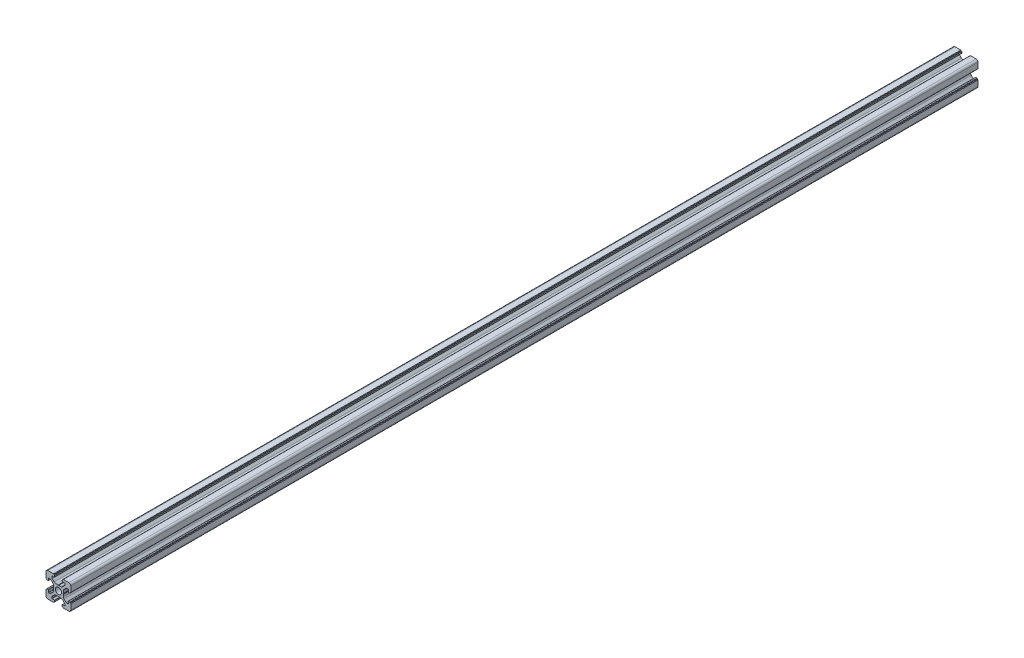
from build123d import *

# Parameters (mm, degrees)
EXTRUDE_1_DEPTH = 732


with BuildPart() as part:
    # Эскиз1 → Бобышка-Вытянуть1 (new body)
    with BuildSketch(Plane.XY):
        with BuildLine():
            Line((-3.8, 0), (-3.945217202, -0.181521503))
            ThreePointArc((-3.945217202, -0.181521503), (-3.98590708, -0.254943529), (-4, -0.337695265))
            Line((-4, -0.337695265), (-4, -1.934136008))
            ThreePointArc((-4, -1.934136008), (-4.152240935, -2.699502873), (-4.585786438, -3.348349571))
            Line((-4.585786438, -3.348349571), (-6.144543648, -4.907106781))
            ThreePointArc((-6.144543648, -4.907106781), (-6.468966997, -5.123879533), (-6.851650429, -5.2))
            Line((-6.851650429, -5.2), (-7.8, -5.2))
            ThreePointArc((-7.8, -5.2), (-7.941421356, -5.141421356), (-8, -5))
            Line((-8, -5), (-8, -3.32))
            ThreePointArc((-8, -3.32), (-8.073223305, -3.143223305), (-8.25, -3.07))
            Line((-8.25, -3.07), (-9.15, -3.07))
            ThreePointArc((-9.15, -3.07), (-9.326776695, -3.143223305), (-9.4, -3.32))
            Line((-9.4, -3.32), (-9.4, -3.7))
            Line((-9.4, -3.7), (-9.75, -3.7))
            ThreePointArc((-9.75, -3.7), (-9.926776695, -3.773223305), (-10, -3.95))
            Line((-10, -3.95), (-10, -8.5))
            ThreePointArc((-10, -8.5), (-9.560660172, -9.560660172), (-8.5, -10))
            Line((-8.5, -10), (-3.95, -10))
            ThreePointArc((-3.95, -10), (-3.773223305, -9.926776695), (-3.7, -9.75))
            Line((-3.7, -9.75), (-3.7, -9.4))
            Line((-3.7, -9.4), (-3.32, -9.4))
            ThreePointArc((-3.32, -9.4), (-3.143223305, -9.326776695), (-3.07, -9.15))
            Line((-3.07, -9.15), (-3.07, -8.25))
            ThreePointArc((-3.07, -8.25), (-3.143223305, -8.073223305), (-3.32, -8))
            Line((-3.32, -8), (-5, -8))
            ThreePointArc((-5, -8), (-5.141421356, -7.941421356), (-5.2, -7.8))
            Line((-5.2, -7.8), (-5.2, -6.851650429))
            ThreePointArc((-5.2, -6.851650429), (-5.123879533, -6.468966997), (-4.907106781, -6.144543648))
            Line((-4.907106781, -6.144543648), (-3.348349571, -4.585786438))
            ThreePointArc((-3.348349571, -4.585786438), (-2.699502873, -4.152240935), (-1.934136008, -4))
            Line((-1.934136008, -4), (-0.337695265, -4))
            ThreePointArc((-0.337695265, -4), (-0.254943529, -3.98590708), (-0.181521503, -3.945217202))
            Line((-0.181521503, -3.945217202), (0, -3.8))
            Line((0, -3.8), (0.181521503, -3.945217202))
            ThreePointArc((0.181521503, -3.945217202), (0.254943529, -3.98590708), (0.337695265, -4))
            Line((0.337695265, -4), (1.934136008, -4))
            ThreePointArc((1.934136008, -4), (2.699502873, -4.152240935), (3.348349571, -4.585786438))
            Line((3.348349571, -4.585786438), (4.907106781, -6.144543648))
            ThreePointArc((4.907106781, -6.144543648), (5.123879533, -6.468966997), (5.2, -6.851650429))
            Line((5.2, -6.851650429), (5.2, -7.8))
            ThreePointArc((5.2, -7.8), (5.141421356, -7.941421356), (5, -8))
            Line((5, -8), (3.32, -8))
            ThreePointArc((3.32, -8), (3.143223305, -8.073223305), (3.07, -8.25))
            Line((3.07, -8.25), (3.07, -9.15))
            ThreePointArc((3.07, -9.15), (3.143223305, -9.326776695), (3.32, -9.4))
            Line((3.32, -9.4), (3.7, -9.4))
            Line((3.7, -9.4), (3.7, -9.75))
            ThreePointArc((3.7, -9.75), (3.773223305, -9.926776695), (3.95, -10))
            Line((3.95, -10), (8.5, -10))
            ThreePointArc((8.5, -10), (9.560660172, -9.560660172), (10, -8.5))
            Line((10, -8.5), (10, -3.95))
            ThreePointArc((10, -3.95), (9.926776695, -3.773223305), (9.75, -3.7))
            Line((9.75, -3.7), (9.4, -3.7))
            Line((9.4, -3.7), (9.4, -3.32))
            ThreePointArc((9.4, -3.32), (9.326776695, -3.143223305), (9.15, -3.07))
            Line((9.15, -3.07), (8.25, -3.07))
            ThreePointArc((8.25, -3.07), (8.073223305, -3.143223305), (8, -3.32))
            Line((8, -3.32), (8, -5))
            ThreePointArc((8, -5), (7.941421356, -5.141421356), (7.8, -5.2))
            Line((7.8, -5.2), (6.851650429, -5.2))
            ThreePointArc((6.851650429, -5.2), (6.468966997, -5.123879533), (6.144543648, -4.907106781))
            Line((6.144543648, -4.907106781), (4.585786438, -3.348349571))
            ThreePointArc((4.585786438, -3.348349571), (4.152240935, -2.699502873), (4, -1.934136008))
            Line((4, -1.934136008), (4, -0.337695265))
            ThreePointArc((4, -0.337695265), (3.98590708, -0.254943529), (3.945217202, -0.181521503))
            Line((3.945217202, -0.181521503), (3.8, 0))
            Line((3.8, 0), (3.945217202, 0.181521503))
            ThreePointArc((3.945217202, 0.181521503), (3.98590708, 0.254943529), (4, 0.337695265))
            Line((4, 0.337695265), (4, 1.934136008))
            ThreePointArc((4, 1.934136008), (4.152240935, 2.699502873), (4.585786438, 3.348349571))
            Line((4.585786438, 3.348349571), (6.144543648, 4.907106781))
            ThreePointArc((6.144543648, 4.907106781), (6.468966997, 5.123879533), (6.851650429, 5.2))
            Line((6.851650429, 5.2), (7.8, 5.2))
            ThreePointArc((7.8, 5.2), (7.941421356, 5.141421356), (8, 5))
            Line((8, 5), (8, 3.32))
            ThreePointArc((8, 3.32), (8.073223305, 3.143223305), (8.25, 3.07))
            Line((8.25, 3.07), (9.15, 3.07))
            ThreePointArc((9.15, 3.07), (9.326776695, 3.143223305), (9.4, 3.32))
            Line((9.4, 3.32), (9.4, 3.7))
            Line((9.4, 3.7), (9.75, 3.7))
            ThreePointArc((9.75, 3.7), (9.926776695, 3.773223305), (10, 3.95))
            Line((10, 3.95), (10, 8.5))
            ThreePointArc((10, 8.5), (9.560660172, 9.560660172), (8.5, 10))
            Line((8.5, 10), (3.95, 10))
            ThreePointArc((3.95, 10), (3.773223305, 9.926776695), (3.7, 9.75))
            Line((3.7, 9.75), (3.7, 9.4))
            Line((3.7, 9.4), (3.32, 9.4))
            ThreePointArc((3.32, 9.4), (3.143223305, 9.326776695), (3.07, 9.15))
            Line((3.07, 9.15), (3.07, 8.25))
            ThreePointArc((3.07, 8.25), (3.143223305, 8.073223305), (3.32, 8))
            Line((3.32, 8), (5, 8))
            ThreePointArc((5, 8), (5.141421356, 7.941421356), (5.2, 7.8))
            Line((5.2, 7.8), (5.2, 6.851650429))
            ThreePointArc((5.2, 6.851650429), (5.123879533, 6.468966997), (4.907106781, 6.144543648))
            Line((4.907106781, 6.144543648), (3.348349571, 4.585786438))
            ThreePointArc((3.348349571, 4.585786438), (2.699502873, 4.152240935), (1.934136008, 4))
            Line((1.934136008, 4), (0.337695265, 4))
            ThreePointArc((0.337695265, 4), (0.254943529, 3.98590708), (0.181521503, 3.945217202))
            Line((0.181521503, 3.945217202), (0, 3.8))
            Line((0, 3.8), (-0.181521503, 3.945217202))
            ThreePointArc((-0.181521503, 3.945217202), (-0.254943529, 3.98590708), (-0.337695265, 4))
            Line((-0.337695265, 4), (-1.934136008, 4))
            ThreePointArc((-1.934136008, 4), (-2.699502873, 4.152240935), (-3.348349571, 4.585786438))
            Line((-3.348349571, 4.585786438), (-4.907106781, 6.144543648))
            ThreePointArc((-4.907106781, 6.144543648), (-5.123879533, 6.468966997), (-5.2, 6.851650429))
            Line((-5.2, 6.851650429), (-5.2, 7.8))
            ThreePointArc((-5.2, 7.8), (-5.141421356, 7.941421356), (-5, 8))
            Line((-5, 8), (-3.32, 8))
            ThreePointArc((-3.32, 8), (-3.143223305, 8.073223305), (-3.07, 8.25))
            Line((-3.07, 8.25), (-3.07, 9.15))
            ThreePointArc((-3.07, 9.15), (-3.143223305, 9.326776695), (-3.32, 9.4))
            Line((-3.32, 9.4), (-3.7, 9.4))
            Line((-3.7, 9.4), (-3.7, 9.75))
            ThreePointArc((-3.7, 9.75), (-3.773223305, 9.926776695), (-3.95, 10))
            Line((-3.95, 10), (-8.5, 10))
            ThreePointArc((-8.5, 10), (-9.560660172, 9.560660172), (-10, 8.5))
            Line((-10, 8.5), (-10, 3.95))
            ThreePointArc((-10, 3.95), (-9.926776695, 3.773223305), (-9.75, 3.7))
            Line((-9.75, 3.7), (-9.4, 3.7))
            Line((-9.4, 3.7), (-9.4, 3.32))
            ThreePointArc((-9.4, 3.32), (-9.326776695, 3.143223305), (-9.15, 3.07))
            Line((-9.15, 3.07), (-8.25, 3.07))
            ThreePointArc((-8.25, 3.07), (-8.073223305, 3.143223305), (-8, 3.32))
            Line((-8, 3.32), (-8, 5))
            ThreePointArc((-8, 5), (-7.941421356, 5.141421356), (-7.8, 5.2))
            Line((-7.8, 5.2), (-6.851650429, 5.2))
            ThreePointArc((-6.851650429, 5.2), (-6.468966997, 5.123879533), (-6.144543648, 4.907106781))
            Line((-6.144543648, 4.907106781), (-4.585786438, 3.348349571))
            ThreePointArc((-4.585786438, 3.348349571), (-4.152240935, 2.699502873), (-4, 1.934136008))
            Line((-4, 1.934136008), (-4, 0.337695265))
            ThreePointArc((-4, 0.337695265), (-3.98590708, 0.254943529), (-3.945217202, 0.181521503))
            Line((-3.945217202, 0.181521503), (-3.8, 0))
        make_face()
        with BuildLine():
            ThreePointArc((2.5, 0), (0, 2.5), (-2.5, 0))
            ThreePointArc((-2.5, 0), (0, -2.5), (2.5, 0))
        make_face(mode=Mode.SUBTRACT)
    extrude(amount=EXTRUDE_1_DEPTH)


solid = part.part
